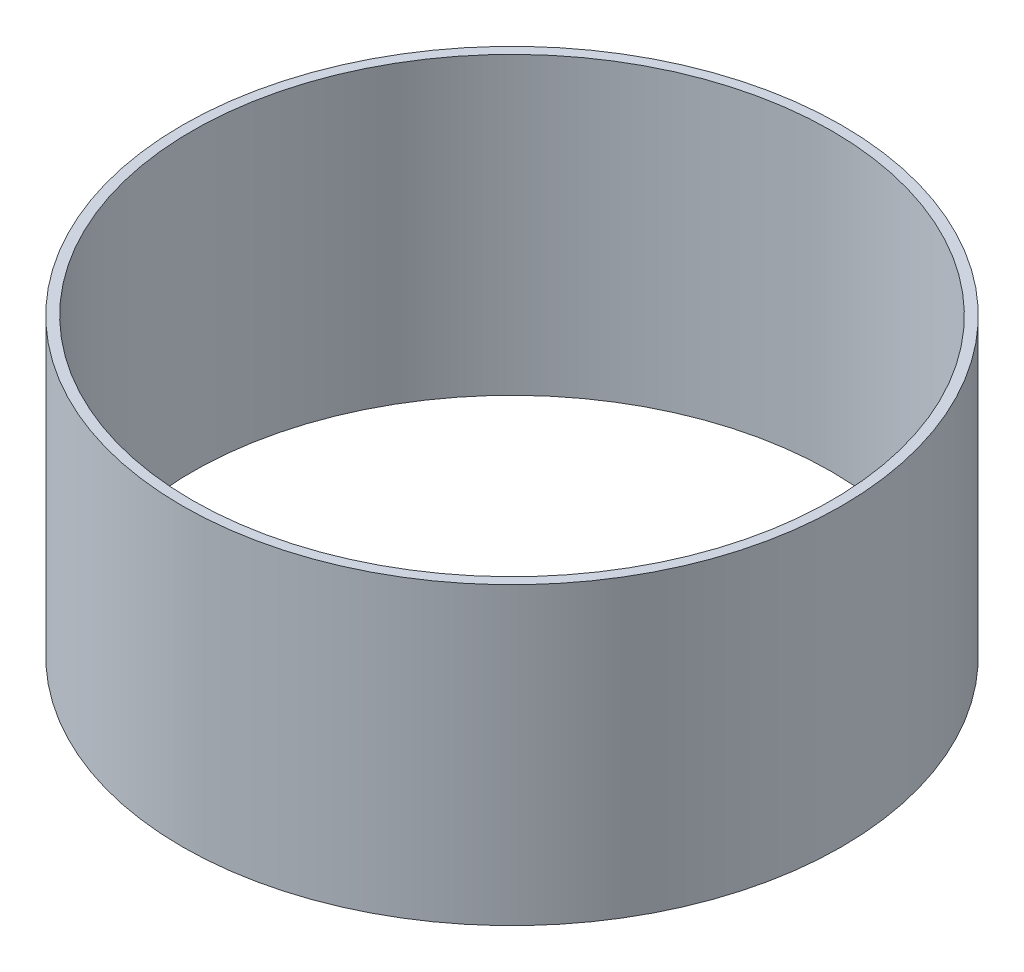
from build123d import *

# Parameters (mm, degrees)
SKETCH1_R           = 33.5
SKETCH1_R_2         = 32.5
BOSS_EXTRUDE1_DEPTH = 30


with BuildPart() as part:
    # Sketch1 → Boss-Extrude1 (new body)
    with BuildSketch(Plane(origin=(0, 0, 0), x_dir=(1, 0, 0), z_dir=(0, 1, 0))):
        with Locations(Location((0, 0, 0), (0, 0, 270))):
            Circle(SKETCH1_R)
        with Locations(Location((0, 0, 0), (0, 0, 270))):
            Circle(SKETCH1_R_2, mode=Mode.SUBTRACT)
    extrude(amount=BOSS_EXTRUDE1_DEPTH)


solid = part.part
